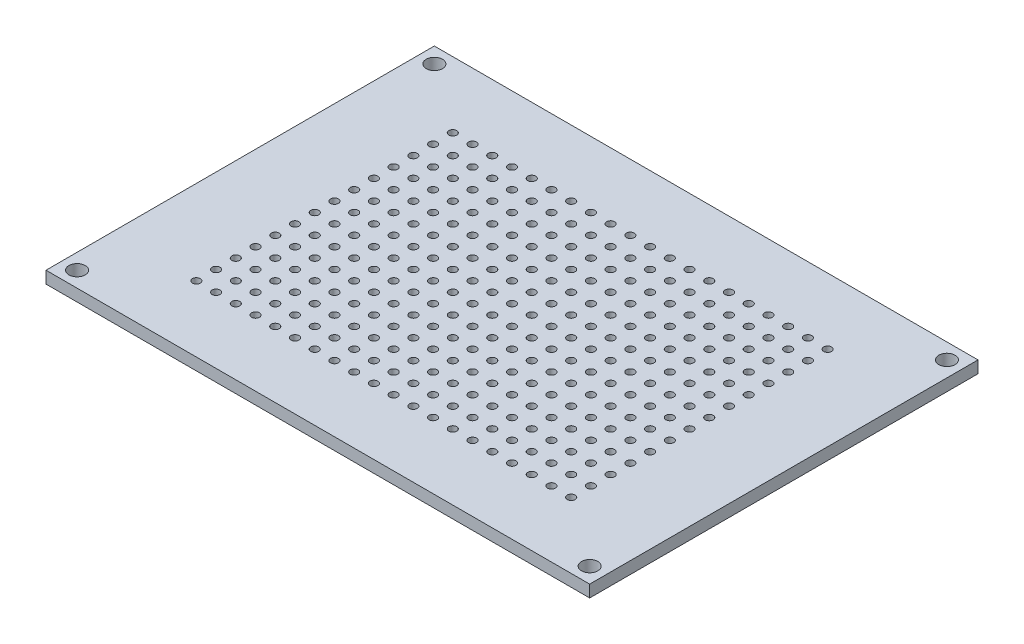
from build123d import *

# Parameters (mm, degrees)
SKETCH1_W           = 70
SKETCH1_H           = 50
SKETCH1_R           = 0.508
SKETCH1_R_2         = 1.05
BOSS_EXTRUDE1_DEPTH = 1.55


with BuildPart() as part:
    # Sketch1 → Boss-Extrude1 (new body)
    with BuildSketch(Plane(origin=(0, 0, 0), x_dir=(1, 0, 0), z_dir=(0, 1, 0))):
        with Locations((35, 25)):
            Rectangle(SKETCH1_W, SKETCH1_H)
        with Locations(Location((33.73, 23.73, 0), (0, 0, 270))):
            Circle(SKETCH1_R, mode=Mode.SUBTRACT)
        with Locations(Location((36.27, 23.73, 0), (0, 0, 270))):
            Circle(SKETCH1_R, mode=Mode.SUBTRACT)
        with Locations(Location((38.81, 23.73, 0), (0, 0, 270))):
            Circle(SKETCH1_R, mode=Mode.SUBTRACT)
        with Locations(Location((41.35, 23.73, 0), (0, 0, 270))):
            Circle(SKETCH1_R, mode=Mode.SUBTRACT)
        with Locations(Location((43.89, 23.73, 0), (0, 0, 270))):
            Circle(SKETCH1_R, mode=Mode.SUBTRACT)
        with Locations(Location((46.43, 23.73, 0), (0, 0, 270))):
            Circle(SKETCH1_R, mode=Mode.SUBTRACT)
        with Locations(Location((48.97, 23.73, 0), (0, 0, 270))):
            Circle(SKETCH1_R, mode=Mode.SUBTRACT)
        with Locations(Location((51.51, 23.73, 0), (0, 0, 270))):
            Circle(SKETCH1_R, mode=Mode.SUBTRACT)
        with Locations(Location((54.05, 23.73, 0), (0, 0, 270))):
            Circle(SKETCH1_R, mode=Mode.SUBTRACT)
        with Locations(Location((56.59, 23.73, 0), (0, 0, 270))):
            Circle(SKETCH1_R, mode=Mode.SUBTRACT)
        with Locations(Location((59.13, 23.73, 0), (0, 0, 270))):
            Circle(SKETCH1_R, mode=Mode.SUBTRACT)
        with Locations(Location((36.27, 26.27, 0), (0, 0, 270))):
            Circle(SKETCH1_R, mode=Mode.SUBTRACT)
        with Locations(Location((38.81, 26.27, 0), (0, 0, 270))):
            Circle(SKETCH1_R, mode=Mode.SUBTRACT)
        with Locations(Location((41.35, 26.27, 0), (0, 0, 270))):
            Circle(SKETCH1_R, mode=Mode.SUBTRACT)
        with Locations(Location((43.89, 26.27, 0), (0, 0, 270))):
            Circle(SKETCH1_R, mode=Mode.SUBTRACT)
        with Locations(Location((46.43, 26.27, 0), (0, 0, 270))):
            Circle(SKETCH1_R, mode=Mode.SUBTRACT)
        with Locations(Location((48.97, 26.27, 0), (0, 0, 270))):
            Circle(SKETCH1_R, mode=Mode.SUBTRACT)
        with Locations(Location((51.51, 26.27, 0), (0, 0, 270))):
            Circle(SKETCH1_R, mode=Mode.SUBTRACT)
        with Locations(Location((54.05, 26.27, 0), (0, 0, 270))):
            Circle(SKETCH1_R, mode=Mode.SUBTRACT)
        with Locations(Location((56.59, 26.27, 0), (0, 0, 270))):
            Circle(SKETCH1_R, mode=Mode.SUBTRACT)
        with Locations(Location((59.13, 26.27, 0), (0, 0, 270))):
            Circle(SKETCH1_R, mode=Mode.SUBTRACT)
        with Locations(Location((36.27, 28.81, 0), (0, 0, 270))):
            Circle(SKETCH1_R, mode=Mode.SUBTRACT)
        with Locations(Location((38.81, 28.81, 0), (0, 0, 270))):
            Circle(SKETCH1_R, mode=Mode.SUBTRACT)
        with Locations(Location((41.35, 28.81, 0), (0, 0, 270))):
            Circle(SKETCH1_R, mode=Mode.SUBTRACT)
        with Locations(Location((43.89, 28.81, 0), (0, 0, 270))):
            Circle(SKETCH1_R, mode=Mode.SUBTRACT)
        with Locations(Location((46.43, 28.81, 0), (0, 0, 270))):
            Circle(SKETCH1_R, mode=Mode.SUBTRACT)
        with Locations(Location((48.97, 28.81, 0), (0, 0, 270))):
            Circle(SKETCH1_R, mode=Mode.SUBTRACT)
        with Locations(Location((51.51, 28.81, 0), (0, 0, 270))):
            Circle(SKETCH1_R, mode=Mode.SUBTRACT)
        with Locations(Location((54.05, 28.81, 0), (0, 0, 270))):
            Circle(SKETCH1_R, mode=Mode.SUBTRACT)
        with Locations(Location((56.59, 28.81, 0), (0, 0, 270))):
            Circle(SKETCH1_R, mode=Mode.SUBTRACT)
        with Locations(Location((59.13, 28.81, 0), (0, 0, 270))):
            Circle(SKETCH1_R, mode=Mode.SUBTRACT)
        with Locations(Location((36.27, 31.35, 0), (0, 0, 270))):
            Circle(SKETCH1_R, mode=Mode.SUBTRACT)
        with Locations(Location((38.81, 31.35, 0), (0, 0, 270))):
            Circle(SKETCH1_R, mode=Mode.SUBTRACT)
        with Locations(Location((41.35, 31.35, 0), (0, 0, 270))):
            Circle(SKETCH1_R, mode=Mode.SUBTRACT)
        with Locations(Location((43.89, 31.35, 0), (0, 0, 270))):
            Circle(SKETCH1_R, mode=Mode.SUBTRACT)
        with Locations(Location((46.43, 31.35, 0), (0, 0, 270))):
            Circle(SKETCH1_R, mode=Mode.SUBTRACT)
        with Locations(Location((48.97, 31.35, 0), (0, 0, 270))):
            Circle(SKETCH1_R, mode=Mode.SUBTRACT)
        with Locations(Location((51.51, 31.35, 0), (0, 0, 270))):
            Circle(SKETCH1_R, mode=Mode.SUBTRACT)
        with Locations(Location((54.05, 31.35, 0), (0, 0, 270))):
            Circle(SKETCH1_R, mode=Mode.SUBTRACT)
        with Locations(Location((56.59, 31.35, 0), (0, 0, 270))):
            Circle(SKETCH1_R, mode=Mode.SUBTRACT)
        with Locations(Location((59.13, 31.35, 0), (0, 0, 270))):
            Circle(SKETCH1_R, mode=Mode.SUBTRACT)
        with Locations(Location((36.27, 33.89, 0), (0, 0, 270))):
            Circle(SKETCH1_R, mode=Mode.SUBTRACT)
        with Locations(Location((38.81, 33.89, 0), (0, 0, 270))):
            Circle(SKETCH1_R, mode=Mode.SUBTRACT)
        with Locations(Location((41.35, 33.89, 0), (0, 0, 270))):
            Circle(SKETCH1_R, mode=Mode.SUBTRACT)
        with Locations(Location((43.89, 33.89, 0), (0, 0, 270))):
            Circle(SKETCH1_R, mode=Mode.SUBTRACT)
        with Locations(Location((46.43, 33.89, 0), (0, 0, 270))):
            Circle(SKETCH1_R, mode=Mode.SUBTRACT)
        with Locations(Location((48.97, 33.89, 0), (0, 0, 270))):
            Circle(SKETCH1_R, mode=Mode.SUBTRACT)
        with Locations(Location((51.51, 33.89, 0), (0, 0, 270))):
            Circle(SKETCH1_R, mode=Mode.SUBTRACT)
        with Locations(Location((54.05, 33.89, 0), (0, 0, 270))):
            Circle(SKETCH1_R, mode=Mode.SUBTRACT)
        with Locations(Location((56.59, 33.89, 0), (0, 0, 270))):
            Circle(SKETCH1_R, mode=Mode.SUBTRACT)
        with Locations(Location((59.13, 33.89, 0), (0, 0, 270))):
            Circle(SKETCH1_R, mode=Mode.SUBTRACT)
        with Locations(Location((36.27, 36.43, 0), (0, 0, 270))):
            Circle(SKETCH1_R, mode=Mode.SUBTRACT)
        with Locations(Location((38.81, 36.43, 0), (0, 0, 270))):
            Circle(SKETCH1_R, mode=Mode.SUBTRACT)
        with Locations(Location((41.35, 36.43, 0), (0, 0, 270))):
            Circle(SKETCH1_R, mode=Mode.SUBTRACT)
        with Locations(Location((43.89, 36.43, 0), (0, 0, 270))):
            Circle(SKETCH1_R, mode=Mode.SUBTRACT)
        with Locations(Location((46.43, 36.43, 0), (0, 0, 270))):
            Circle(SKETCH1_R, mode=Mode.SUBTRACT)
        with Locations(Location((48.97, 36.43, 0), (0, 0, 270))):
            Circle(SKETCH1_R, mode=Mode.SUBTRACT)
        with Locations(Location((51.51, 36.43, 0), (0, 0, 270))):
            Circle(SKETCH1_R, mode=Mode.SUBTRACT)
        with Locations(Location((54.05, 36.43, 0), (0, 0, 270))):
            Circle(SKETCH1_R, mode=Mode.SUBTRACT)
        with Locations(Location((56.59, 36.43, 0), (0, 0, 270))):
            Circle(SKETCH1_R, mode=Mode.SUBTRACT)
        with Locations(Location((59.13, 36.43, 0), (0, 0, 270))):
            Circle(SKETCH1_R, mode=Mode.SUBTRACT)
        with Locations(Location((36.27, 38.97, 0), (0, 0, 270))):
            Circle(SKETCH1_R, mode=Mode.SUBTRACT)
        with Locations(Location((38.81, 38.97, 0), (0, 0, 270))):
            Circle(SKETCH1_R, mode=Mode.SUBTRACT)
        with Locations(Location((41.35, 38.97, 0), (0, 0, 270))):
            Circle(SKETCH1_R, mode=Mode.SUBTRACT)
        with Locations(Location((43.89, 38.97, 0), (0, 0, 270))):
            Circle(SKETCH1_R, mode=Mode.SUBTRACT)
        with Locations(Location((46.43, 38.97, 0), (0, 0, 270))):
            Circle(SKETCH1_R, mode=Mode.SUBTRACT)
        with Locations(Location((48.97, 38.97, 0), (0, 0, 270))):
            Circle(SKETCH1_R, mode=Mode.SUBTRACT)
        with Locations(Location((51.51, 38.97, 0), (0, 0, 270))):
            Circle(SKETCH1_R, mode=Mode.SUBTRACT)
        with Locations(Location((54.05, 38.97, 0), (0, 0, 270))):
            Circle(SKETCH1_R, mode=Mode.SUBTRACT)
        with Locations(Location((56.59, 38.97, 0), (0, 0, 270))):
            Circle(SKETCH1_R, mode=Mode.SUBTRACT)
        with Locations(Location((59.13, 38.97, 0), (0, 0, 270))):
            Circle(SKETCH1_R, mode=Mode.SUBTRACT)
        with Locations(Location((36.27, 41.51, 0), (0, 0, 270))):
            Circle(SKETCH1_R, mode=Mode.SUBTRACT)
        with Locations(Location((38.81, 41.51, 0), (0, 0, 270))):
            Circle(SKETCH1_R, mode=Mode.SUBTRACT)
        with Locations(Location((41.35, 41.51, 0), (0, 0, 270))):
            Circle(SKETCH1_R, mode=Mode.SUBTRACT)
        with Locations(Location((43.89, 41.51, 0), (0, 0, 270))):
            Circle(SKETCH1_R, mode=Mode.SUBTRACT)
        with Locations(Location((46.43, 41.51, 0), (0, 0, 270))):
            Circle(SKETCH1_R, mode=Mode.SUBTRACT)
        with Locations(Location((48.97, 41.51, 0), (0, 0, 270))):
            Circle(SKETCH1_R, mode=Mode.SUBTRACT)
        with Locations(Location((51.51, 41.51, 0), (0, 0, 270))):
            Circle(SKETCH1_R, mode=Mode.SUBTRACT)
        with Locations(Location((54.05, 41.51, 0), (0, 0, 270))):
            Circle(SKETCH1_R, mode=Mode.SUBTRACT)
        with Locations(Location((56.59, 41.51, 0), (0, 0, 270))):
            Circle(SKETCH1_R, mode=Mode.SUBTRACT)
        with Locations(Location((59.13, 41.51, 0), (0, 0, 270))):
            Circle(SKETCH1_R, mode=Mode.SUBTRACT)
        with Locations(Location((33.73, 26.27, 0), (0, 0, 270))):
            Circle(SKETCH1_R, mode=Mode.SUBTRACT)
        with Locations(Location((33.73, 28.81, 0), (0, 0, 270))):
            Circle(SKETCH1_R, mode=Mode.SUBTRACT)
        with Locations(Location((33.73, 31.35, 0), (0, 0, 270))):
            Circle(SKETCH1_R, mode=Mode.SUBTRACT)
        with Locations(Location((33.73, 33.89, 0), (0, 0, 270))):
            Circle(SKETCH1_R, mode=Mode.SUBTRACT)
        with Locations(Location((33.73, 36.43, 0), (0, 0, 270))):
            Circle(SKETCH1_R, mode=Mode.SUBTRACT)
        with Locations(Location((33.73, 38.97, 0), (0, 0, 270))):
            Circle(SKETCH1_R, mode=Mode.SUBTRACT)
        with Locations(Location((33.73, 41.51, 0), (0, 0, 270))):
            Circle(SKETCH1_R, mode=Mode.SUBTRACT)
        with Locations(Location((31.19, 41.51, 0), (0, 0, 270))):
            Circle(SKETCH1_R, mode=Mode.SUBTRACT)
        with Locations(Location((28.65, 41.51, 0), (0, 0, 270))):
            Circle(SKETCH1_R, mode=Mode.SUBTRACT)
        with Locations(Location((26.11, 41.51, 0), (0, 0, 270))):
            Circle(SKETCH1_R, mode=Mode.SUBTRACT)
        with Locations(Location((23.57, 41.51, 0), (0, 0, 270))):
            Circle(SKETCH1_R, mode=Mode.SUBTRACT)
        with Locations(Location((21.03, 41.51, 0), (0, 0, 270))):
            Circle(SKETCH1_R, mode=Mode.SUBTRACT)
        with Locations(Location((18.49, 41.51, 0), (0, 0, 270))):
            Circle(SKETCH1_R, mode=Mode.SUBTRACT)
        with Locations(Location((15.95, 41.51, 0), (0, 0, 270))):
            Circle(SKETCH1_R, mode=Mode.SUBTRACT)
        with Locations(Location((13.41, 41.51, 0), (0, 0, 270))):
            Circle(SKETCH1_R, mode=Mode.SUBTRACT)
        with Locations(Location((10.87, 41.51, 0), (0, 0, 270))):
            Circle(SKETCH1_R, mode=Mode.SUBTRACT)
        with Locations(Location((31.19, 38.97, 0), (0, 0, 270))):
            Circle(SKETCH1_R, mode=Mode.SUBTRACT)
        with Locations(Location((28.65, 38.97, 0), (0, 0, 270))):
            Circle(SKETCH1_R, mode=Mode.SUBTRACT)
        with Locations(Location((26.11, 38.97, 0), (0, 0, 270))):
            Circle(SKETCH1_R, mode=Mode.SUBTRACT)
        with Locations(Location((23.57, 38.97, 0), (0, 0, 270))):
            Circle(SKETCH1_R, mode=Mode.SUBTRACT)
        with Locations(Location((21.03, 38.97, 0), (0, 0, 270))):
            Circle(SKETCH1_R, mode=Mode.SUBTRACT)
        with Locations(Location((18.49, 38.97, 0), (0, 0, 270))):
            Circle(SKETCH1_R, mode=Mode.SUBTRACT)
        with Locations(Location((15.95, 38.97, 0), (0, 0, 270))):
            Circle(SKETCH1_R, mode=Mode.SUBTRACT)
        with Locations(Location((13.41, 38.97, 0), (0, 0, 270))):
            Circle(SKETCH1_R, mode=Mode.SUBTRACT)
        with Locations(Location((10.87, 38.97, 0), (0, 0, 270))):
            Circle(SKETCH1_R, mode=Mode.SUBTRACT)
        with Locations(Location((31.19, 36.43, 0), (0, 0, 270))):
            Circle(SKETCH1_R, mode=Mode.SUBTRACT)
        with Locations(Location((28.65, 36.43, 0), (0, 0, 270))):
            Circle(SKETCH1_R, mode=Mode.SUBTRACT)
        with Locations(Location((26.11, 36.43, 0), (0, 0, 270))):
            Circle(SKETCH1_R, mode=Mode.SUBTRACT)
        with Locations(Location((23.57, 36.43, 0), (0, 0, 270))):
            Circle(SKETCH1_R, mode=Mode.SUBTRACT)
        with Locations(Location((21.03, 36.43, 0), (0, 0, 270))):
            Circle(SKETCH1_R, mode=Mode.SUBTRACT)
        with Locations(Location((18.49, 36.43, 0), (0, 0, 270))):
            Circle(SKETCH1_R, mode=Mode.SUBTRACT)
        with Locations(Location((15.95, 36.43, 0), (0, 0, 270))):
            Circle(SKETCH1_R, mode=Mode.SUBTRACT)
        with Locations(Location((13.41, 36.43, 0), (0, 0, 270))):
            Circle(SKETCH1_R, mode=Mode.SUBTRACT)
        with Locations(Location((10.87, 36.43, 0), (0, 0, 270))):
            Circle(SKETCH1_R, mode=Mode.SUBTRACT)
        with Locations(Location((31.19, 33.89, 0), (0, 0, 270))):
            Circle(SKETCH1_R, mode=Mode.SUBTRACT)
        with Locations(Location((28.65, 33.89, 0), (0, 0, 270))):
            Circle(SKETCH1_R, mode=Mode.SUBTRACT)
        with Locations(Location((26.11, 33.89, 0), (0, 0, 270))):
            Circle(SKETCH1_R, mode=Mode.SUBTRACT)
        with Locations(Location((23.57, 33.89, 0), (0, 0, 270))):
            Circle(SKETCH1_R, mode=Mode.SUBTRACT)
        with Locations(Location((21.03, 33.89, 0), (0, 0, 270))):
            Circle(SKETCH1_R, mode=Mode.SUBTRACT)
        with Locations(Location((18.49, 33.89, 0), (0, 0, 270))):
            Circle(SKETCH1_R, mode=Mode.SUBTRACT)
        with Locations(Location((15.95, 33.89, 0), (0, 0, 270))):
            Circle(SKETCH1_R, mode=Mode.SUBTRACT)
        with Locations(Location((13.41, 33.89, 0), (0, 0, 270))):
            Circle(SKETCH1_R, mode=Mode.SUBTRACT)
        with Locations(Location((10.87, 33.89, 0), (0, 0, 270))):
            Circle(SKETCH1_R, mode=Mode.SUBTRACT)
        with Locations(Location((31.19, 31.35, 0), (0, 0, 270))):
            Circle(SKETCH1_R, mode=Mode.SUBTRACT)
        with Locations(Location((28.65, 31.35, 0), (0, 0, 270))):
            Circle(SKETCH1_R, mode=Mode.SUBTRACT)
        with Locations(Location((26.11, 31.35, 0), (0, 0, 270))):
            Circle(SKETCH1_R, mode=Mode.SUBTRACT)
        with Locations(Location((23.57, 31.35, 0), (0, 0, 270))):
            Circle(SKETCH1_R, mode=Mode.SUBTRACT)
        with Locations(Location((21.03, 31.35, 0), (0, 0, 270))):
            Circle(SKETCH1_R, mode=Mode.SUBTRACT)
        with Locations(Location((18.49, 31.35, 0), (0, 0, 270))):
            Circle(SKETCH1_R, mode=Mode.SUBTRACT)
        with Locations(Location((15.95, 31.35, 0), (0, 0, 270))):
            Circle(SKETCH1_R, mode=Mode.SUBTRACT)
        with Locations(Location((13.41, 31.35, 0), (0, 0, 270))):
            Circle(SKETCH1_R, mode=Mode.SUBTRACT)
        with Locations(Location((10.87, 31.35, 0), (0, 0, 270))):
            Circle(SKETCH1_R, mode=Mode.SUBTRACT)
        with Locations(Location((31.19, 28.81, 0), (0, 0, 270))):
            Circle(SKETCH1_R, mode=Mode.SUBTRACT)
        with Locations(Location((28.65, 28.81, 0), (0, 0, 270))):
            Circle(SKETCH1_R, mode=Mode.SUBTRACT)
        with Locations(Location((26.11, 28.81, 0), (0, 0, 270))):
            Circle(SKETCH1_R, mode=Mode.SUBTRACT)
        with Locations(Location((23.57, 28.81, 0), (0, 0, 270))):
            Circle(SKETCH1_R, mode=Mode.SUBTRACT)
        with Locations(Location((21.03, 28.81, 0), (0, 0, 270))):
            Circle(SKETCH1_R, mode=Mode.SUBTRACT)
        with Locations(Location((18.49, 28.81, 0), (0, 0, 270))):
            Circle(SKETCH1_R, mode=Mode.SUBTRACT)
        with Locations(Location((15.95, 28.81, 0), (0, 0, 270))):
            Circle(SKETCH1_R, mode=Mode.SUBTRACT)
        with Locations(Location((13.41, 28.81, 0), (0, 0, 270))):
            Circle(SKETCH1_R, mode=Mode.SUBTRACT)
        with Locations(Location((10.87, 28.81, 0), (0, 0, 270))):
            Circle(SKETCH1_R, mode=Mode.SUBTRACT)
        with Locations(Location((31.19, 26.27, 0), (0, 0, 270))):
            Circle(SKETCH1_R, mode=Mode.SUBTRACT)
        with Locations(Location((28.65, 26.27, 0), (0, 0, 270))):
            Circle(SKETCH1_R, mode=Mode.SUBTRACT)
        with Locations(Location((26.11, 26.27, 0), (0, 0, 270))):
            Circle(SKETCH1_R, mode=Mode.SUBTRACT)
        with Locations(Location((23.57, 26.27, 0), (0, 0, 270))):
            Circle(SKETCH1_R, mode=Mode.SUBTRACT)
        with Locations(Location((21.03, 26.27, 0), (0, 0, 270))):
            Circle(SKETCH1_R, mode=Mode.SUBTRACT)
        with Locations(Location((18.49, 26.27, 0), (0, 0, 270))):
            Circle(SKETCH1_R, mode=Mode.SUBTRACT)
        with Locations(Location((15.95, 26.27, 0), (0, 0, 270))):
            Circle(SKETCH1_R, mode=Mode.SUBTRACT)
        with Locations(Location((13.41, 26.27, 0), (0, 0, 270))):
            Circle(SKETCH1_R, mode=Mode.SUBTRACT)
        with Locations(Location((10.87, 26.27, 0), (0, 0, 270))):
            Circle(SKETCH1_R, mode=Mode.SUBTRACT)
        with Locations(Location((31.19, 23.73, 0), (0, 0, 270))):
            Circle(SKETCH1_R, mode=Mode.SUBTRACT)
        with Locations(Location((28.65, 23.73, 0), (0, 0, 270))):
            Circle(SKETCH1_R, mode=Mode.SUBTRACT)
        with Locations(Location((26.11, 23.73, 0), (0, 0, 270))):
            Circle(SKETCH1_R, mode=Mode.SUBTRACT)
        with Locations(Location((23.57, 23.73, 0), (0, 0, 270))):
            Circle(SKETCH1_R, mode=Mode.SUBTRACT)
        with Locations(Location((21.03, 23.73, 0), (0, 0, 270))):
            Circle(SKETCH1_R, mode=Mode.SUBTRACT)
        with Locations(Location((18.49, 23.73, 0), (0, 0, 270))):
            Circle(SKETCH1_R, mode=Mode.SUBTRACT)
        with Locations(Location((15.95, 23.73, 0), (0, 0, 270))):
            Circle(SKETCH1_R, mode=Mode.SUBTRACT)
        with Locations(Location((13.41, 23.73, 0), (0, 0, 270))):
            Circle(SKETCH1_R, mode=Mode.SUBTRACT)
        with Locations(Location((10.87, 23.73, 0), (0, 0, 270))):
            Circle(SKETCH1_R, mode=Mode.SUBTRACT)
        with Locations(Location((56.59, 21.19, 0), (0, 0, 270))):
            Circle(SKETCH1_R, mode=Mode.SUBTRACT)
        with Locations(Location((54.05, 21.19, 0), (0, 0, 270))):
            Circle(SKETCH1_R, mode=Mode.SUBTRACT)
        with Locations(Location((51.51, 21.19, 0), (0, 0, 270))):
            Circle(SKETCH1_R, mode=Mode.SUBTRACT)
        with Locations(Location((48.97, 21.19, 0), (0, 0, 270))):
            Circle(SKETCH1_R, mode=Mode.SUBTRACT)
        with Locations(Location((46.43, 21.19, 0), (0, 0, 270))):
            Circle(SKETCH1_R, mode=Mode.SUBTRACT)
        with Locations(Location((43.89, 21.19, 0), (0, 0, 270))):
            Circle(SKETCH1_R, mode=Mode.SUBTRACT)
        with Locations(Location((41.35, 21.19, 0), (0, 0, 270))):
            Circle(SKETCH1_R, mode=Mode.SUBTRACT)
        with Locations(Location((38.81, 21.19, 0), (0, 0, 270))):
            Circle(SKETCH1_R, mode=Mode.SUBTRACT)
        with Locations(Location((36.27, 21.19, 0), (0, 0, 270))):
            Circle(SKETCH1_R, mode=Mode.SUBTRACT)
        with Locations(Location((33.73, 21.19, 0), (0, 0, 270))):
            Circle(SKETCH1_R, mode=Mode.SUBTRACT)
        with Locations(Location((31.19, 21.19, 0), (0, 0, 270))):
            Circle(SKETCH1_R, mode=Mode.SUBTRACT)
        with Locations(Location((28.65, 21.19, 0), (0, 0, 270))):
            Circle(SKETCH1_R, mode=Mode.SUBTRACT)
        with Locations(Location((26.11, 21.19, 0), (0, 0, 270))):
            Circle(SKETCH1_R, mode=Mode.SUBTRACT)
        with Locations(Location((23.57, 21.19, 0), (0, 0, 270))):
            Circle(SKETCH1_R, mode=Mode.SUBTRACT)
        with Locations(Location((21.03, 21.19, 0), (0, 0, 270))):
            Circle(SKETCH1_R, mode=Mode.SUBTRACT)
        with Locations(Location((18.49, 21.19, 0), (0, 0, 270))):
            Circle(SKETCH1_R, mode=Mode.SUBTRACT)
        with Locations(Location((15.95, 21.19, 0), (0, 0, 270))):
            Circle(SKETCH1_R, mode=Mode.SUBTRACT)
        with Locations(Location((13.41, 21.19, 0), (0, 0, 270))):
            Circle(SKETCH1_R, mode=Mode.SUBTRACT)
        with Locations(Location((10.87, 21.19, 0), (0, 0, 270))):
            Circle(SKETCH1_R, mode=Mode.SUBTRACT)
        with Locations(Location((56.59, 18.65, 0), (0, 0, 270))):
            Circle(SKETCH1_R, mode=Mode.SUBTRACT)
        with Locations(Location((54.05, 18.65, 0), (0, 0, 270))):
            Circle(SKETCH1_R, mode=Mode.SUBTRACT)
        with Locations(Location((51.51, 18.65, 0), (0, 0, 270))):
            Circle(SKETCH1_R, mode=Mode.SUBTRACT)
        with Locations(Location((48.97, 18.65, 0), (0, 0, 270))):
            Circle(SKETCH1_R, mode=Mode.SUBTRACT)
        with Locations(Location((46.43, 18.65, 0), (0, 0, 270))):
            Circle(SKETCH1_R, mode=Mode.SUBTRACT)
        with Locations(Location((43.89, 18.65, 0), (0, 0, 270))):
            Circle(SKETCH1_R, mode=Mode.SUBTRACT)
        with Locations(Location((41.35, 18.65, 0), (0, 0, 270))):
            Circle(SKETCH1_R, mode=Mode.SUBTRACT)
        with Locations(Location((38.81, 18.65, 0), (0, 0, 270))):
            Circle(SKETCH1_R, mode=Mode.SUBTRACT)
        with Locations(Location((36.27, 18.65, 0), (0, 0, 270))):
            Circle(SKETCH1_R, mode=Mode.SUBTRACT)
        with Locations(Location((33.73, 18.65, 0), (0, 0, 270))):
            Circle(SKETCH1_R, mode=Mode.SUBTRACT)
        with Locations(Location((31.19, 18.65, 0), (0, 0, 270))):
            Circle(SKETCH1_R, mode=Mode.SUBTRACT)
        with Locations(Location((28.65, 18.65, 0), (0, 0, 270))):
            Circle(SKETCH1_R, mode=Mode.SUBTRACT)
        with Locations(Location((26.11, 18.65, 0), (0, 0, 270))):
            Circle(SKETCH1_R, mode=Mode.SUBTRACT)
        with Locations(Location((23.57, 18.65, 0), (0, 0, 270))):
            Circle(SKETCH1_R, mode=Mode.SUBTRACT)
        with Locations(Location((21.03, 18.65, 0), (0, 0, 270))):
            Circle(SKETCH1_R, mode=Mode.SUBTRACT)
        with Locations(Location((18.49, 18.65, 0), (0, 0, 270))):
            Circle(SKETCH1_R, mode=Mode.SUBTRACT)
        with Locations(Location((15.95, 18.65, 0), (0, 0, 270))):
            Circle(SKETCH1_R, mode=Mode.SUBTRACT)
        with Locations(Location((13.41, 18.65, 0), (0, 0, 270))):
            Circle(SKETCH1_R, mode=Mode.SUBTRACT)
        with Locations(Location((10.87, 18.65, 0), (0, 0, 270))):
            Circle(SKETCH1_R, mode=Mode.SUBTRACT)
        with Locations(Location((56.59, 16.11, 0), (0, 0, 270))):
            Circle(SKETCH1_R, mode=Mode.SUBTRACT)
        with Locations(Location((54.05, 16.11, 0), (0, 0, 270))):
            Circle(SKETCH1_R, mode=Mode.SUBTRACT)
        with Locations(Location((51.51, 16.11, 0), (0, 0, 270))):
            Circle(SKETCH1_R, mode=Mode.SUBTRACT)
        with Locations(Location((48.97, 16.11, 0), (0, 0, 270))):
            Circle(SKETCH1_R, mode=Mode.SUBTRACT)
        with Locations(Location((46.43, 16.11, 0), (0, 0, 270))):
            Circle(SKETCH1_R, mode=Mode.SUBTRACT)
        with Locations(Location((43.89, 16.11, 0), (0, 0, 270))):
            Circle(SKETCH1_R, mode=Mode.SUBTRACT)
        with Locations(Location((41.35, 16.11, 0), (0, 0, 270))):
            Circle(SKETCH1_R, mode=Mode.SUBTRACT)
        with Locations(Location((38.81, 16.11, 0), (0, 0, 270))):
            Circle(SKETCH1_R, mode=Mode.SUBTRACT)
        with Locations(Location((36.27, 16.11, 0), (0, 0, 270))):
            Circle(SKETCH1_R, mode=Mode.SUBTRACT)
        with Locations(Location((33.73, 16.11, 0), (0, 0, 270))):
            Circle(SKETCH1_R, mode=Mode.SUBTRACT)
        with Locations(Location((31.19, 16.11, 0), (0, 0, 270))):
            Circle(SKETCH1_R, mode=Mode.SUBTRACT)
        with Locations(Location((28.65, 16.11, 0), (0, 0, 270))):
            Circle(SKETCH1_R, mode=Mode.SUBTRACT)
        with Locations(Location((26.11, 16.11, 0), (0, 0, 270))):
            Circle(SKETCH1_R, mode=Mode.SUBTRACT)
        with Locations(Location((23.57, 16.11, 0), (0, 0, 270))):
            Circle(SKETCH1_R, mode=Mode.SUBTRACT)
        with Locations(Location((21.03, 16.11, 0), (0, 0, 270))):
            Circle(SKETCH1_R, mode=Mode.SUBTRACT)
        with Locations(Location((18.49, 16.11, 0), (0, 0, 270))):
            Circle(SKETCH1_R, mode=Mode.SUBTRACT)
        with Locations(Location((15.95, 16.11, 0), (0, 0, 270))):
            Circle(SKETCH1_R, mode=Mode.SUBTRACT)
        with Locations(Location((13.41, 16.11, 0), (0, 0, 270))):
            Circle(SKETCH1_R, mode=Mode.SUBTRACT)
        with Locations(Location((10.87, 16.11, 0), (0, 0, 270))):
            Circle(SKETCH1_R, mode=Mode.SUBTRACT)
        with Locations(Location((56.59, 13.57, 0), (0, 0, 270))):
            Circle(SKETCH1_R, mode=Mode.SUBTRACT)
        with Locations(Location((54.05, 13.57, 0), (0, 0, 270))):
            Circle(SKETCH1_R, mode=Mode.SUBTRACT)
        with Locations(Location((51.51, 13.57, 0), (0, 0, 270))):
            Circle(SKETCH1_R, mode=Mode.SUBTRACT)
        with Locations(Location((48.97, 13.57, 0), (0, 0, 270))):
            Circle(SKETCH1_R, mode=Mode.SUBTRACT)
        with Locations(Location((46.43, 13.57, 0), (0, 0, 270))):
            Circle(SKETCH1_R, mode=Mode.SUBTRACT)
        with Locations(Location((43.89, 13.57, 0), (0, 0, 270))):
            Circle(SKETCH1_R, mode=Mode.SUBTRACT)
        with Locations(Location((41.35, 13.57, 0), (0, 0, 270))):
            Circle(SKETCH1_R, mode=Mode.SUBTRACT)
        with Locations(Location((38.81, 13.57, 0), (0, 0, 270))):
            Circle(SKETCH1_R, mode=Mode.SUBTRACT)
        with Locations(Location((36.27, 13.57, 0), (0, 0, 270))):
            Circle(SKETCH1_R, mode=Mode.SUBTRACT)
        with Locations(Location((33.73, 13.57, 0), (0, 0, 270))):
            Circle(SKETCH1_R, mode=Mode.SUBTRACT)
        with Locations(Location((31.19, 13.57, 0), (0, 0, 270))):
            Circle(SKETCH1_R, mode=Mode.SUBTRACT)
        with Locations(Location((28.65, 13.57, 0), (0, 0, 270))):
            Circle(SKETCH1_R, mode=Mode.SUBTRACT)
        with Locations(Location((26.11, 13.57, 0), (0, 0, 270))):
            Circle(SKETCH1_R, mode=Mode.SUBTRACT)
        with Locations(Location((23.57, 13.57, 0), (0, 0, 270))):
            Circle(SKETCH1_R, mode=Mode.SUBTRACT)
        with Locations(Location((21.03, 13.57, 0), (0, 0, 270))):
            Circle(SKETCH1_R, mode=Mode.SUBTRACT)
        with Locations(Location((18.49, 13.57, 0), (0, 0, 270))):
            Circle(SKETCH1_R, mode=Mode.SUBTRACT)
        with Locations(Location((15.95, 13.57, 0), (0, 0, 270))):
            Circle(SKETCH1_R, mode=Mode.SUBTRACT)
        with Locations(Location((13.41, 13.57, 0), (0, 0, 270))):
            Circle(SKETCH1_R, mode=Mode.SUBTRACT)
        with Locations(Location((10.87, 13.57, 0), (0, 0, 270))):
            Circle(SKETCH1_R, mode=Mode.SUBTRACT)
        with Locations(Location((56.59, 11.03, 0), (0, 0, 270))):
            Circle(SKETCH1_R, mode=Mode.SUBTRACT)
        with Locations(Location((54.05, 11.03, 0), (0, 0, 270))):
            Circle(SKETCH1_R, mode=Mode.SUBTRACT)
        with Locations(Location((51.51, 11.03, 0), (0, 0, 270))):
            Circle(SKETCH1_R, mode=Mode.SUBTRACT)
        with Locations(Location((48.97, 11.03, 0), (0, 0, 270))):
            Circle(SKETCH1_R, mode=Mode.SUBTRACT)
        with Locations(Location((46.43, 11.03, 0), (0, 0, 270))):
            Circle(SKETCH1_R, mode=Mode.SUBTRACT)
        with Locations(Location((43.89, 11.03, 0), (0, 0, 270))):
            Circle(SKETCH1_R, mode=Mode.SUBTRACT)
        with Locations(Location((41.35, 11.03, 0), (0, 0, 270))):
            Circle(SKETCH1_R, mode=Mode.SUBTRACT)
        with Locations(Location((38.81, 11.03, 0), (0, 0, 270))):
            Circle(SKETCH1_R, mode=Mode.SUBTRACT)
        with Locations(Location((36.27, 11.03, 0), (0, 0, 270))):
            Circle(SKETCH1_R, mode=Mode.SUBTRACT)
        with Locations(Location((33.73, 11.03, 0), (0, 0, 270))):
            Circle(SKETCH1_R, mode=Mode.SUBTRACT)
        with Locations(Location((31.19, 11.03, 0), (0, 0, 270))):
            Circle(SKETCH1_R, mode=Mode.SUBTRACT)
        with Locations(Location((28.65, 11.03, 0), (0, 0, 270))):
            Circle(SKETCH1_R, mode=Mode.SUBTRACT)
        with Locations(Location((26.11, 11.03, 0), (0, 0, 270))):
            Circle(SKETCH1_R, mode=Mode.SUBTRACT)
        with Locations(Location((23.57, 11.03, 0), (0, 0, 270))):
            Circle(SKETCH1_R, mode=Mode.SUBTRACT)
        with Locations(Location((21.03, 11.03, 0), (0, 0, 270))):
            Circle(SKETCH1_R, mode=Mode.SUBTRACT)
        with Locations(Location((18.49, 11.03, 0), (0, 0, 270))):
            Circle(SKETCH1_R, mode=Mode.SUBTRACT)
        with Locations(Location((15.95, 11.03, 0), (0, 0, 270))):
            Circle(SKETCH1_R, mode=Mode.SUBTRACT)
        with Locations(Location((13.41, 11.03, 0), (0, 0, 270))):
            Circle(SKETCH1_R, mode=Mode.SUBTRACT)
        with Locations(Location((10.87, 11.03, 0), (0, 0, 270))):
            Circle(SKETCH1_R, mode=Mode.SUBTRACT)
        with Locations(Location((56.59, 8.49, 0), (0, 0, 270))):
            Circle(SKETCH1_R, mode=Mode.SUBTRACT)
        with Locations(Location((54.05, 8.49, 0), (0, 0, 270))):
            Circle(SKETCH1_R, mode=Mode.SUBTRACT)
        with Locations(Location((51.51, 8.49, 0), (0, 0, 270))):
            Circle(SKETCH1_R, mode=Mode.SUBTRACT)
        with Locations(Location((48.97, 8.49, 0), (0, 0, 270))):
            Circle(SKETCH1_R, mode=Mode.SUBTRACT)
        with Locations(Location((46.43, 8.49, 0), (0, 0, 270))):
            Circle(SKETCH1_R, mode=Mode.SUBTRACT)
        with Locations(Location((43.89, 8.49, 0), (0, 0, 270))):
            Circle(SKETCH1_R, mode=Mode.SUBTRACT)
        with Locations(Location((41.35, 8.49, 0), (0, 0, 270))):
            Circle(SKETCH1_R, mode=Mode.SUBTRACT)
        with Locations(Location((38.81, 8.49, 0), (0, 0, 270))):
            Circle(SKETCH1_R, mode=Mode.SUBTRACT)
        with Locations(Location((36.27, 8.49, 0), (0, 0, 270))):
            Circle(SKETCH1_R, mode=Mode.SUBTRACT)
        with Locations(Location((33.73, 8.49, 0), (0, 0, 270))):
            Circle(SKETCH1_R, mode=Mode.SUBTRACT)
        with Locations(Location((31.19, 8.49, 0), (0, 0, 270))):
            Circle(SKETCH1_R, mode=Mode.SUBTRACT)
        with Locations(Location((28.65, 8.49, 0), (0, 0, 270))):
            Circle(SKETCH1_R, mode=Mode.SUBTRACT)
        with Locations(Location((26.11, 8.49, 0), (0, 0, 270))):
            Circle(SKETCH1_R, mode=Mode.SUBTRACT)
        with Locations(Location((23.57, 8.49, 0), (0, 0, 270))):
            Circle(SKETCH1_R, mode=Mode.SUBTRACT)
        with Locations(Location((21.03, 8.49, 0), (0, 0, 270))):
            Circle(SKETCH1_R, mode=Mode.SUBTRACT)
        with Locations(Location((18.49, 8.49, 0), (0, 0, 270))):
            Circle(SKETCH1_R, mode=Mode.SUBTRACT)
        with Locations(Location((15.95, 8.49, 0), (0, 0, 270))):
            Circle(SKETCH1_R, mode=Mode.SUBTRACT)
        with Locations(Location((13.41, 8.49, 0), (0, 0, 270))):
            Circle(SKETCH1_R, mode=Mode.SUBTRACT)
        with Locations(Location((10.87, 8.49, 0), (0, 0, 270))):
            Circle(SKETCH1_R, mode=Mode.SUBTRACT)
        with Locations(Location((59.13, 21.19, 0), (0, 0, 270))):
            Circle(SKETCH1_R, mode=Mode.SUBTRACT)
        with Locations(Location((59.13, 18.65, 0), (0, 0, 270))):
            Circle(SKETCH1_R, mode=Mode.SUBTRACT)
        with Locations(Location((59.13, 16.11, 0), (0, 0, 270))):
            Circle(SKETCH1_R, mode=Mode.SUBTRACT)
        with Locations(Location((59.13, 13.57, 0), (0, 0, 270))):
            Circle(SKETCH1_R, mode=Mode.SUBTRACT)
        with Locations(Location((59.13, 11.03, 0), (0, 0, 270))):
            Circle(SKETCH1_R, mode=Mode.SUBTRACT)
        with Locations(Location((59.13, 8.49, 0), (0, 0, 270))):
            Circle(SKETCH1_R, mode=Mode.SUBTRACT)
        with Locations(Location((2, 2, 0), (0, 0, 90))):
            Circle(SKETCH1_R_2, mode=Mode.SUBTRACT)
        with Locations(Location((68, 2, 0), (0, 0, 90))):
            Circle(SKETCH1_R_2, mode=Mode.SUBTRACT)
        with Locations(Location((68, 48, 0), (0, 0, 90))):
            Circle(SKETCH1_R_2, mode=Mode.SUBTRACT)
        with Locations(Location((2, 48, 0), (0, 0, 90))):
            Circle(SKETCH1_R_2, mode=Mode.SUBTRACT)
    extrude(amount=BOSS_EXTRUDE1_DEPTH)


solid = part.part
